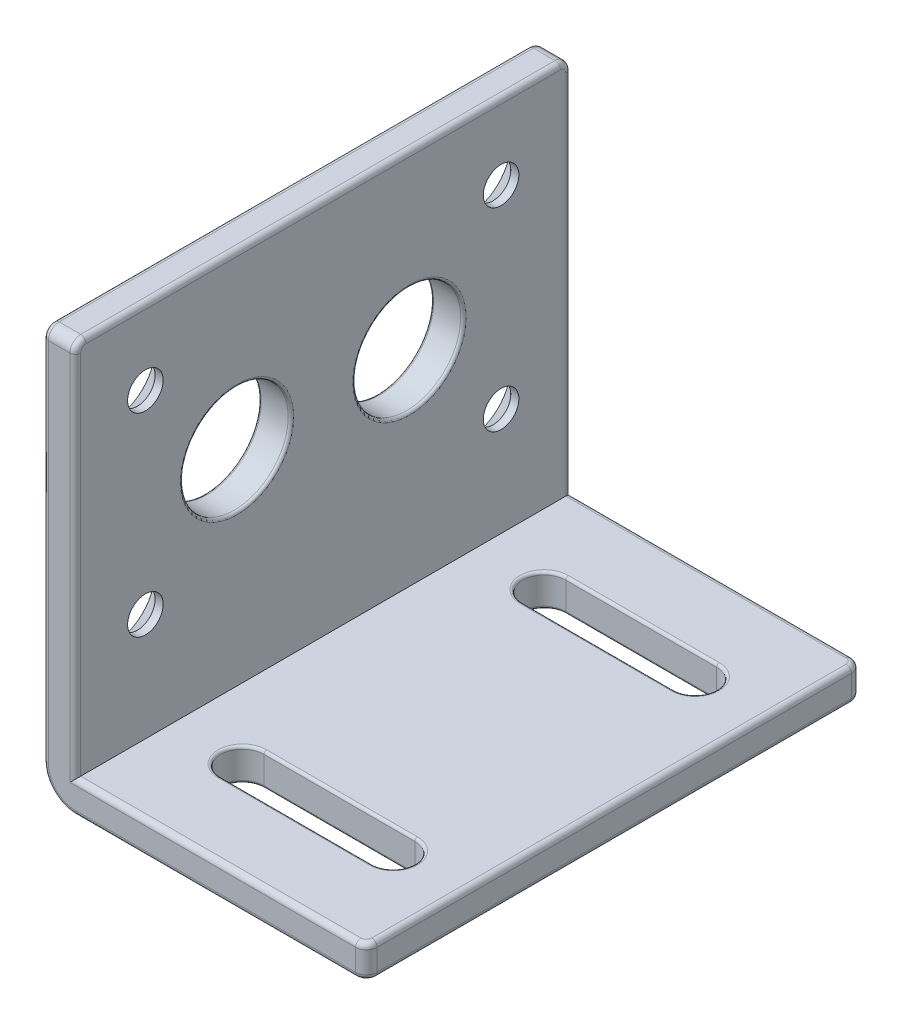
from build123d import *

# Parameters (mm, degrees)
EXTRUDE_1_DEPTH     = 46
SKETCH_3_R          = 1.65
SKETCH_3_R_2        = 5
CUT_EXTRUDE_1_DEPTH = 67.783231428
CHAMFER_2_SIZE      = 2.25
CUT_EXTRUDE_2_DEPTH = 67.783231428
FILLET_1_R          = 1
FILLET_2_R          = 3
FILLET_3_R          = 0.5
FILLET_4_R          = 0.25


with BuildPart() as part:
    # 草图2 → 凸台-拉伸1 (new body)
    with BuildSketch(Plane.XY):
        Polygon((0, 0), (0, 38), (3, 38), (3, 3), (30, 3), (30, 0), align=None)
    extrude(amount=-EXTRUDE_1_DEPTH)

    # 草图3 → 切除-拉伸1 (cut, through all)
    with BuildSketch(Plane.ZY):
        with Locations((-39.5, 31)):
            Circle(SKETCH_3_R)
        with Locations((-31, 22)):
            Circle(SKETCH_3_R_2)
        with Locations((-39.5, 13)):
            Circle(SKETCH_3_R)
        with Locations((-15, 22)):
            Circle(SKETCH_3_R_2)
        with Locations((-6.5, 13)):
            Circle(SKETCH_3_R)
        with Locations((-6.5, 31)):
            Circle(SKETCH_3_R)
    extrude(amount=-CUT_EXTRUDE_1_DEPTH, mode=Mode.SUBTRACT)

    # 倒角2
    chamfer_2_edges = [part.edges().sort_by_distance(p)[0] for p in [
        (0, 31, -8.15),
        (0, 13, -8.15),
        (0, 13, -41.15),
        (0, 31, -41.15),
    ]]
    chamfer(chamfer_2_edges, length=CHAMFER_2_SIZE)

    # 草图4 → 切除-拉伸2 (cut, through all)
    with BuildSketch(Plane.XZ):
        with BuildLine():
            ThreePointArc((23.5, -35), (25.5, -37), (23.5, -39))
            Line((23.5, -39), (9.5, -39))
            ThreePointArc((9.5, -39), (7.5, -37), (9.5, -35))
            Line((9.5, -35), (23.5, -35))
        make_face()
        with BuildLine():
            Line((9.5, -11), (23.5, -11))
            ThreePointArc((23.5, -11), (25.5, -9), (23.5, -7))
            Line((23.5, -7), (9.5, -7))
            ThreePointArc((9.5, -7), (7.5, -9), (9.5, -11))
        make_face()
    extrude(amount=-CUT_EXTRUDE_2_DEPTH, mode=Mode.SUBTRACT)

    # 圆角1
    fillet_1_edges = [part.edges().sort_by_distance(p)[0] for p in [
        (1.5, 38, -46),
        (1.5, 38, 0),
        (30, 1.5, 0),
        (30, 1.5, -46),
    ]]
    fillet(fillet_1_edges, radius=FILLET_1_R)

    # 圆角2
    fillet_2_edges = [part.edges().sort_by_distance(p)[0] for p in [
        (0, 0, -23),
    ]]
    fillet(fillet_2_edges, radius=FILLET_2_R)

    # 圆角3
    fillet_3_edges = [part.edges().sort_by_distance(p)[0] for p in [
        (30, 0, -23),
        (30, 3, -23),
        (16, 3, 0),
        (16, 3, -46),
        (29.707106781, 3, -0.292893219),
        (29.707106781, 3, -45.707106781),
        (0, 20, -46),
        (29.707106781, 0, -0.292893219),
        (29.707106781, 0, -45.707106781),
        (0, 20, 0),
        (3, 38, -23),
        (0, 38, -23),
        (0, 37.707106781, -0.292893219),
        (0, 37.707106781, -45.707106781),
        (3, 37.707106781, -0.292893219),
        (3, 37.707106781, -45.707106781),
        (16, 0, 0),
        (0.878679656, 0.878679656, 0),
        (16, 0, -46),
        (0.878679656, 0.878679656, -46),
        (3, 20, -46),
        (3, 20, 0),
    ]]
    fillet(fillet_3_edges, radius=FILLET_3_R)

    # 圆角4
    fillet_4_edges = [part.edges().sort_by_distance(p)[0] for p in [
        (3, 22, -20),
        (0, 22, -20),
        (3, 22, -36),
        (0, 22, -36),
        (25.5, 3, -9),
        (16.5, 3, -7),
        (7.5, 3, -9),
        (16.5, 3, -11),
        (16.5, 3, -35),
        (7.5, 3, -37),
        (16.5, 3, -39),
        (25.5, 3, -37),
        (25.5, 0, -37),
        (7.5, 0, -37),
        (16.5, 0, -35),
        (16.5, 0, -39),
        (16.5, 0, -7),
        (16.5, 0, -11),
        (25.5, 0, -9),
        (7.5, 0, -9),
    ]]
    fillet(fillet_4_edges, radius=FILLET_4_R)


solid = part.part
